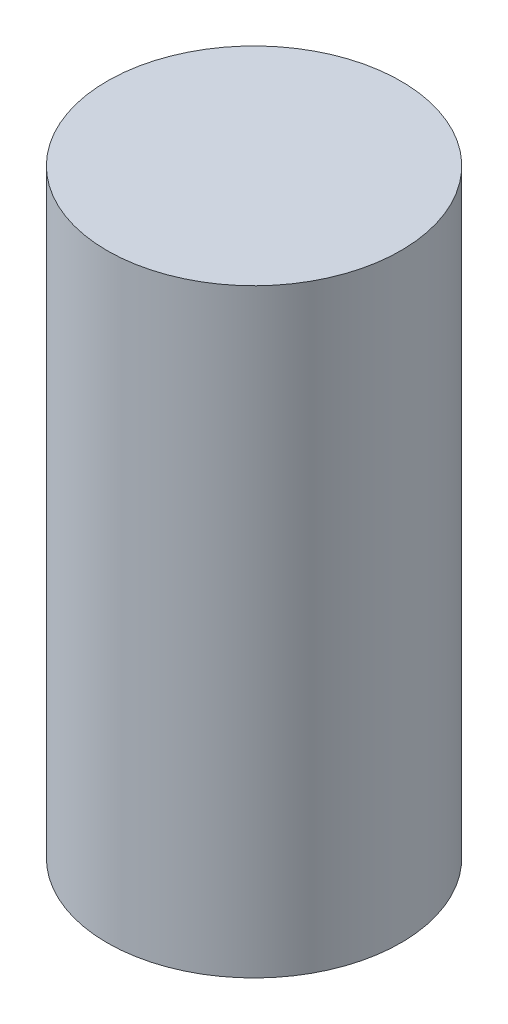
from build123d import *

# Parameters (mm, degrees)
SKETCH1_R           = 4.9
BOSS_EXTRUDE1_DEPTH = 20


with BuildPart() as part:
    # Sketch1 → Boss-Extrude1 (new body)
    with BuildSketch(Plane(origin=(0, 0, 0), x_dir=(1, 0, 0), z_dir=(0, 1, 0))):
        with Locations(Location((0, 0, 0), (0, 0, 270))):
            Circle(SKETCH1_R)
    extrude(amount=BOSS_EXTRUDE1_DEPTH)


solid = part.part
